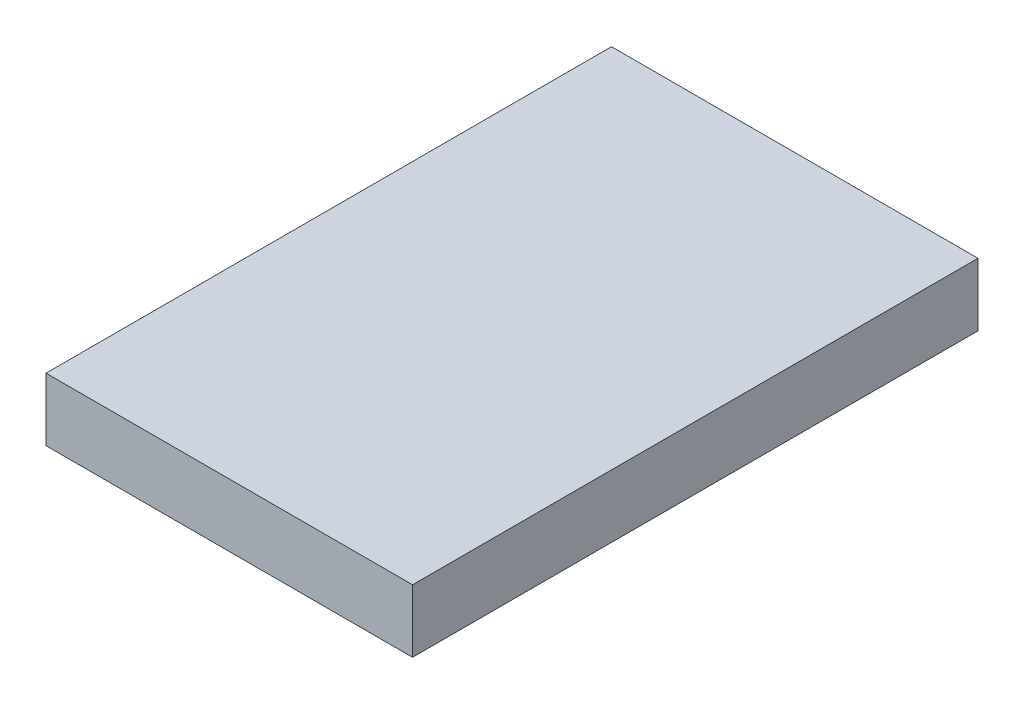
from build123d import *

# Parameters (mm, degrees)
SKETCH1_W           = 55.5625
SKETCH1_H           = 85.725
BOSS_EXTRUDE1_DEPTH = 9.525


with BuildPart() as part:
    # Sketch1 → Boss-Extrude1 (new body)
    with BuildSketch(Plane(origin=(0, 0, 0), x_dir=(1, 0, 0), z_dir=(0, 1, 0))):
        with Locations((27.78125, 42.8625)):
            Rectangle(SKETCH1_W, SKETCH1_H)
    extrude(amount=BOSS_EXTRUDE1_DEPTH)


solid = part.part
